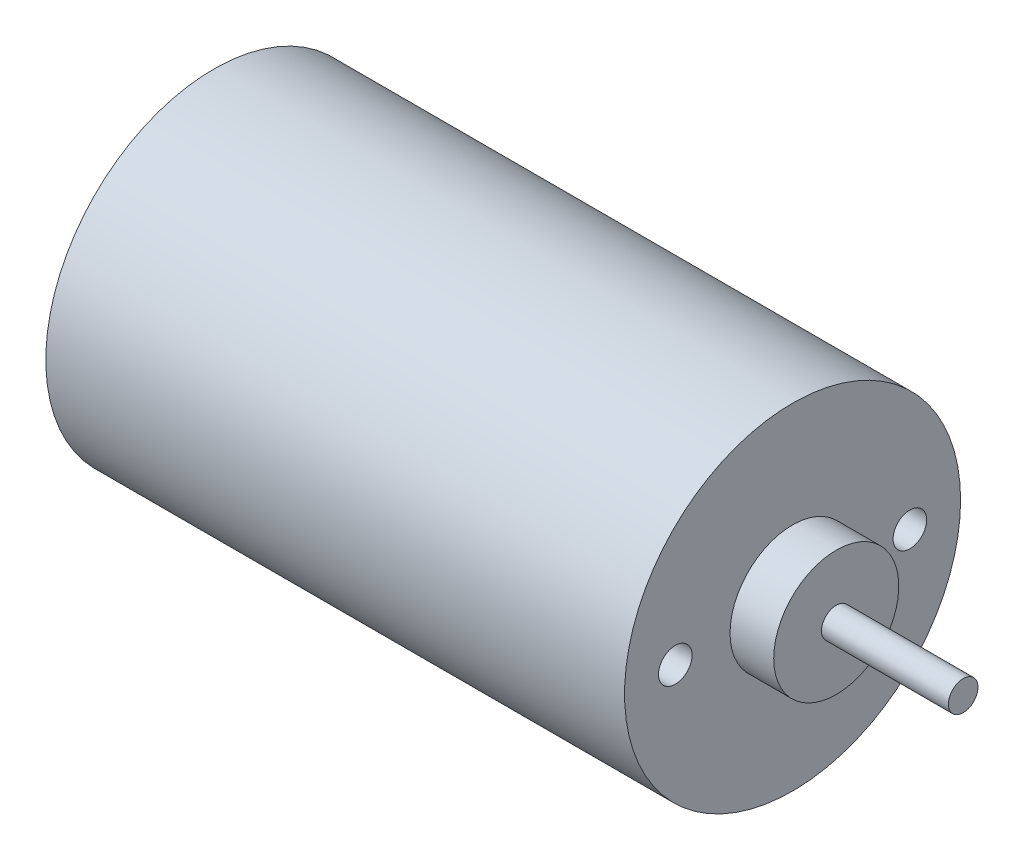
from build123d import *

# Parameters (mm, degrees)
SKETCH1_R           = 18
BOSS_EXTRUDE1_DEPTH = 62
SKETCH2_R           = 6.7
BOSS_EXTRUDE2_DEPTH = 4.68
SKETCH3_R           = 1.585
BOSS_EXTRUDE3_DEPTH = 13.6
SKETCH4_R           = 1.8
CUT_EXTRUDE1_DEPTH  = 20


with BuildPart() as part:
    # Sketch1 → Boss-Extrude1 (new body)
    with BuildSketch(Plane(origin=(0, 0, 0), x_dir=(0, 0, -1), z_dir=(1, 0, 0))):
        Circle(SKETCH1_R)
    extrude(amount=BOSS_EXTRUDE1_DEPTH)

    # Sketch2 → Boss-Extrude2 (add)
    with BuildSketch(Plane(origin=(62, 0, 0), x_dir=(0, 0, -1), z_dir=(1, 0, 0))):
        with Locations(Location((0, 0, 0), (0, 0, 180))):
            Circle(SKETCH2_R)
    extrude(amount=BOSS_EXTRUDE2_DEPTH)

    # Sketch3 → Boss-Extrude3 (add)
    with BuildSketch(Plane(origin=(66.68, 0, 0), x_dir=(0, 0, -1), z_dir=(1, 0, 0))):
        Circle(SKETCH3_R)
    extrude(amount=BOSS_EXTRUDE3_DEPTH)

    # Sketch4 → Cut-Extrude1 (cut)
    with BuildSketch(Plane(origin=(62, 0, 0), x_dir=(0, 0, -1), z_dir=(1, 0, 0))):
        with Locations((-12.565, 0)):
            Circle(SKETCH4_R)
        with Locations((12.565, 0)):
            Circle(SKETCH4_R)
    extrude(amount=-CUT_EXTRUDE1_DEPTH, mode=Mode.SUBTRACT)


solid = part.part
